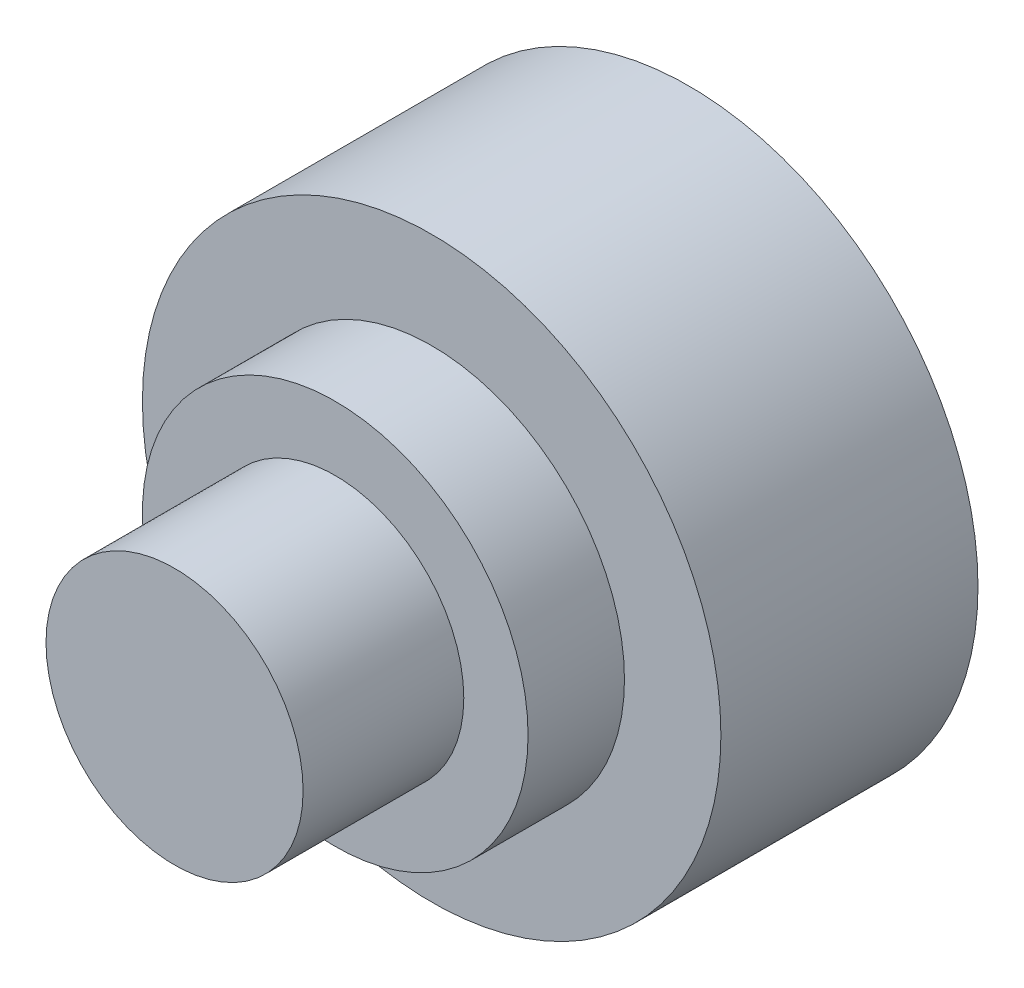
from build123d import *

# Parameters (mm, degrees)
SKETCH1_R           = 9
BOSS_EXTRUDE1_DEPTH = 8
SKETCH2_R           = 6
BOSS_EXTRUDE2_DEPTH = 3
SKETCH3_R           = 4
BOSS_EXTRUDE3_DEPTH = 5


with BuildPart() as part:
    # Sketch1 → Boss-Extrude1 (new body)
    with BuildSketch(Plane.XY):
        Circle(SKETCH1_R)
    extrude(amount=BOSS_EXTRUDE1_DEPTH)

    # Sketch2 → Boss-Extrude2 (add)
    with BuildSketch(Plane.XY.offset(8)):
        Circle(SKETCH2_R)
    extrude(amount=BOSS_EXTRUDE2_DEPTH)

    # Sketch3 → Boss-Extrude3 (add)
    with BuildSketch(Plane.XY.offset(11)):
        Circle(SKETCH3_R)
    extrude(amount=BOSS_EXTRUDE3_DEPTH)


solid = part.part
